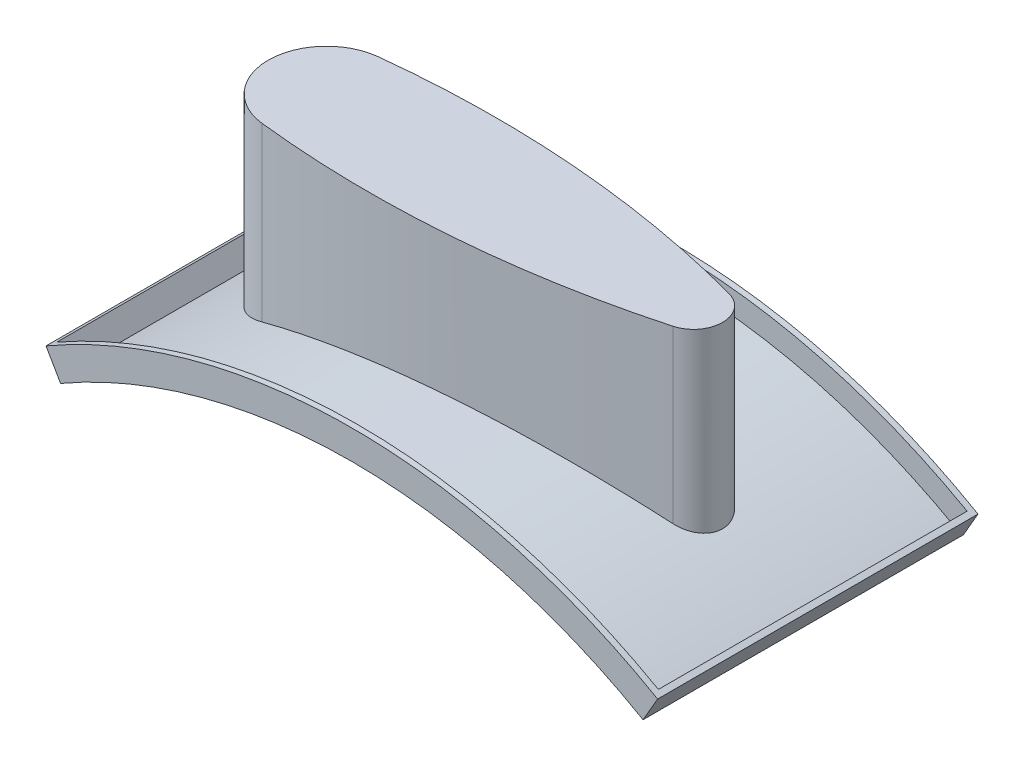
from build123d import *

# Parameters (mm, degrees)
BOSS_EXTRUDE1_DEPTH      = 110
SHELL1_T                 = -2
BOSS_EXTRUDE2_REACH      = 172.36
BOSS_EXTRUDE2_END_RADIUS = 202


with BuildPart() as part:
    # Sketch1 → Boss-Extrude1 (new body)
    with BuildSketch(Plane.XY):
        with BuildLine():
            Line((-105, 181.865334795), (-100, 173.205080757))
            ThreePointArc((-100, 173.205080757), (0, 200), (100, 173.205080757))
            Line((100, 173.205080757), (105, 181.865334795))
            ThreePointArc((105, 181.865334795), (0, 210), (-105, 181.865334795))
        make_face()
    extrude(amount=-BOSS_EXTRUDE1_DEPTH)

    # Shell1
    shell1_openings = [part.faces().sort_by_distance(p)[0] for p in [
        (0, 210, -55),
    ]]
    offset(amount=SHELL1_T, openings=shell1_openings, kind=Kind.INTERSECTION)

    # Boss-Extrude2: up to this cylinder (the profile starts outside it)
    boss_extrude2_end = Plane(origin=(0, 0, -55), z_dir=(0, 0, 1)) * Cylinder(BOSS_EXTRUDE2_END_RADIUS, 749.72, mode=Mode.PRIVATE)
    # Sketch2 → Boss-Extrude2 (add, up to the surface)
    with BuildSketch(Plane(origin=(0, 250, 0), x_dir=(1, 0, 0), z_dir=(0, 1, 0)), mode=Mode.PRIVATE) as boss_extrude2_sk1:
        with BuildLine():
            ThreePointArc((-65.897237959, 35.122057745), (-83.691016821, 55), (-65.897237959, 74.877942255))
            ThreePointArc((-65.897237959, 74.877942255), (0, 75.948538311), (64.929649868, 64.646648447))
            ThreePointArc((64.929649868, 64.646648447), (72.294849357, 55), (64.929649868, 45.353351553))
            ThreePointArc((64.929649868, 45.353351553), (0, 34.051461689), (-65.897237959, 35.122057745))
        make_face()
    boss_extrude2_tool1 = extrude(boss_extrude2_sk1.sketch, amount=-BOSS_EXTRUDE2_REACH, mode=Mode.PRIVATE) - boss_extrude2_end
    add(boss_extrude2_tool1.solids().sort_by_distance((-11.41561, 250, -55))[0])


solid = part.part
